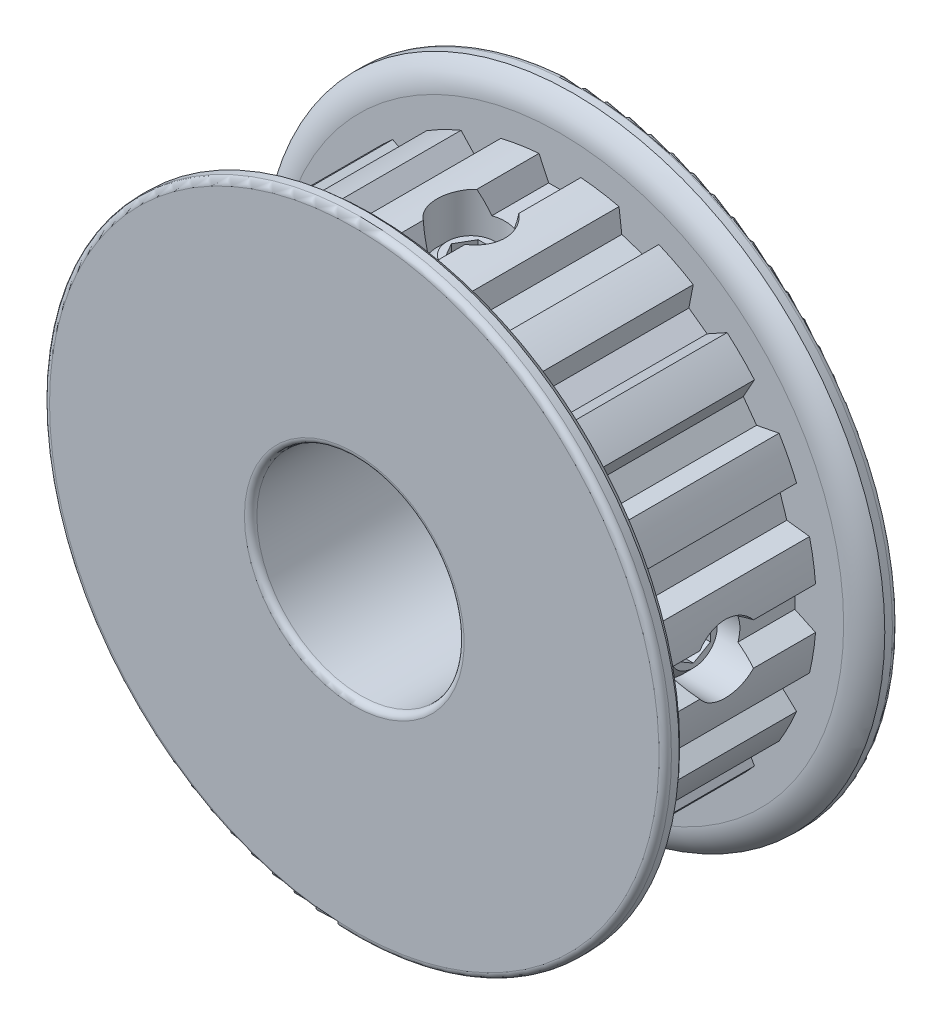
from build123d import *

# Parameters (mm, degrees)
CUT_EXTRUDE1_START = 5.4483
CUT_EXTRUDE1_DEPTH = 10.8966
CIRPATTERN1_COUNT  = 20
FILLET1_R          = 0.381
SKETCH5_R          = 2.0828
CUT_EXTRUDE2_DEPTH = 28.873444958
CUT_EXTRUDE3_DEPTH = 1.0414
CIRPATTERN2_COUNT  = 2
CIRPATTERN2_ANGLE  = 270


with BuildPart() as part:
    # Sketch2 → Revolve1 (revolve)
    with BuildSketch(Plane(origin=(0, 0, 0), x_dir=(0, 0, -1), z_dir=(1, 0, 0)), mode=Mode.PRIVATE) as revolve1_sk:
        with BuildLine():
            Line((-7.1501, 6.35), (7.1501, 6.35))
            Line((7.1501, 6.35), (7.1501, 19.05))
            Line((7.1501, 19.05), (6.2992, 19.05))
            ThreePointArc((6.2992, 19.05), (5.673295941, 18.317569828), (5.4483, 17.380773865))
            Line((5.4483, 17.380773865), (5.4483, 15.711547731))
            Line((5.4483, 15.711547731), (-5.4483, 15.711547731))
            Line((-5.4483, 15.711547731), (-5.4483, 17.380773865))
            ThreePointArc((-5.4483, 17.380773865), (-5.673295941, 18.317569828), (-6.2992, 19.05))
            Line((-6.2992, 19.05), (-7.1501, 19.05))
            Line((-7.1501, 19.05), (-7.1501, 6.35))
        make_face()
    revolve(revolve1_sk.sketch.rotate(Axis((0, 0, 7.1501), (0, 0, -1)), 90), axis=Axis((0, 0, 7.1501), (0, 0, -1)))

    # Sketch3 → Cut-Extrude1 (cut)
    with BuildSketch(Plane.XY.offset(CUT_EXTRUDE1_START)):
        with BuildLine():
            Line((-0.690489274, 14.3891), (0.690489274, 14.3891))
            Line((0.690489274, 14.3891), (1.2827, 15.6591))
            ThreePointArc((1.2827, 15.6591), (0, 15.711547731), (-1.2827, 15.6591))
            Line((-1.2827, 15.6591), (-0.690489274, 14.3891))
        make_face()
    cut_extrude1 = extrude(amount=-CUT_EXTRUDE1_DEPTH, mode=Mode.SUBTRACT)

    # CirPattern1: Cut-Extrude1 ×20 about axis
    cirpattern1_axis = Axis((0, 0, 0), (0, 0, 1))
    for i in range(1, CIRPATTERN1_COUNT):
        add(cut_extrude1.rotate(cirpattern1_axis, i * 360 / CIRPATTERN1_COUNT), mode=Mode.SUBTRACT)

    # Fillet1
    fillet1_edges = [part.edges().sort_by_distance(p)[0] for p in [
        (-19.05, 0, -7.1501),
        (-6.35, 0, -7.1501),
        (-6.35, 0, 7.1501),
        (-19.05, 0, 7.1501),
    ]]
    fillet(fillet1_edges, radius=FILLET1_R)

    # Sketch5 → Cut-Extrude2 (cut, through all)
    with BuildSketch(Plane(origin=(0, 0, 0), x_dir=(1, 0, 0), z_dir=(0, 1, 0))):
        with Locations(Location((0, 0, 0), (0, 0, 90))):
            Circle(SKETCH5_R)
    cut_extrude2 = extrude(amount=CUT_EXTRUDE2_DEPTH, mode=Mode.SUBTRACT)

    # Sketch6 → Revolve2 (revolve)
    with BuildSketch(Plane(origin=(0, 0, 0), x_dir=(0, 0, -1), z_dir=(1, 0, 0)), mode=Mode.PRIVATE) as revolve2_sk:
        Polygon((0, 13.6271), (0, 7.112), (-1.45796, 7.112), (-2.0828, 7.73684), (-2.0828, 13.00226), (-1.45796, 13.6271), align=None)
    revolve2 = revolve(revolve2_sk.sketch.rotate(Axis((0, 13.6271, 0), (0, -1, 0)), 180), axis=Axis((0, 13.6271, 0), (0, -1, 0)))

    # Sketch7 → Cut-Extrude3 (cut)
    with BuildSketch(Plane(origin=(0, 13.6271, 0), x_dir=(1, 0, 0), z_dir=(0, 1, 0))):
        Polygon((1.202505141, 0), (0.60125257, 1.0414), (-0.60125257, 1.0414), (-1.202505141, 0), (-0.60125257, -1.0414), (0.60125257, -1.0414), align=None)
    cut_extrude3 = extrude(amount=-CUT_EXTRUDE3_DEPTH, mode=Mode.SUBTRACT)

    # CirPattern2: Cut-Extrude2, Revolve2, Cut-Extrude3 ×2 about axis
    cirpattern2_axis = Axis((0, 0, 0), (0, 0, 1))
    add([cut_extrude2.rotate(cirpattern2_axis, i * CIRPATTERN2_ANGLE / (CIRPATTERN2_COUNT - 1)) for i in range(1, CIRPATTERN2_COUNT)], mode=Mode.SUBTRACT)
    add([revolve2.rotate(cirpattern2_axis, i * CIRPATTERN2_ANGLE / (CIRPATTERN2_COUNT - 1)) for i in range(1, CIRPATTERN2_COUNT)])
    add([cut_extrude3.rotate(cirpattern2_axis, i * CIRPATTERN2_ANGLE / (CIRPATTERN2_COUNT - 1)) for i in range(1, CIRPATTERN2_COUNT)], mode=Mode.SUBTRACT)


solid = part.part
